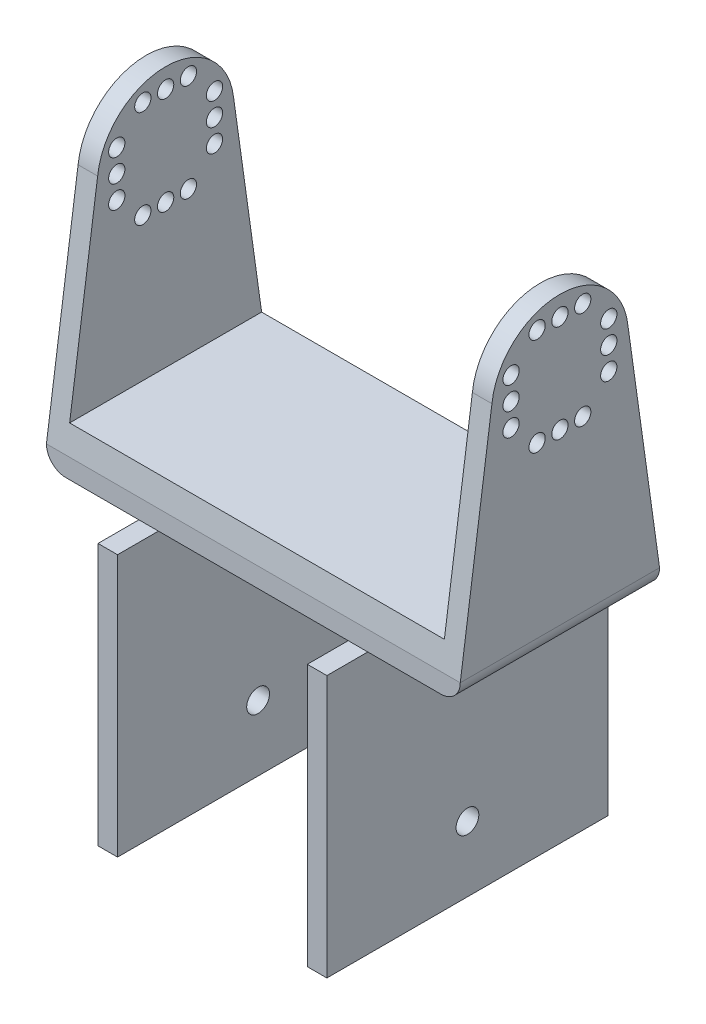
from build123d import *

# Parameters (mm, degrees)
SKETCH2_W           = 63.52
SKETCH2_H           = 30.59
BOSS_EXTRUDE1_DEPTH = 7
SKETCH3_W           = 3
SKETCH3_H           = 30.59
BOSS_EXTRUDE2_DEPTH = 40
FILLET2_R           = 3
SKETCH4_R           = 1.25
CUT_EXTRUDE2_DEPTH  = 70
SKETCH14_W          = 3
SKETCH14_H          = 43.15
BOSS_EXTRUDE5_DEPTH = 40.2
SKETCH15_R          = 1.75
CUT_EXTRUDE9_DEPTH  = 40


with BuildPart() as part:
    # Sketch2 → Boss-Extrude1 (new body)
    with BuildSketch(Plane(origin=(0, 0, 0), x_dir=(1, 0, 0), z_dir=(0, 1, 0))):
        with Locations((-20.26308022, 14.924105874)):
            Rectangle(SKETCH2_W, SKETCH2_H)
    extrude(amount=BOSS_EXTRUDE1_DEPTH)

    # Sketch3 → Boss-Extrude2 (add)
    with BuildSketch(Plane(origin=(0, 7, 0), x_dir=(1, 0, 0), z_dir=(0, 1, 0))):
        with Locations((-50.52308022, 14.924105874)):
            Rectangle(SKETCH3_W, SKETCH3_H)
        with Locations((9.99691978, 14.924105874)):
            Rectangle(SKETCH3_W, SKETCH3_H)
    extrude(amount=BOSS_EXTRUDE2_DEPTH)

    # Fillet2
    fillet2_edges = [part.edges().sort_by_distance(p)[0] for p in [
        (11.49691978, 0, -14.924105874),
        (-52.02308022, 0, -14.924105874),
    ]]
    fillet(fillet2_edges, radius=FILLET2_R)

    # Sketch4 → Cut-Extrude2 (cut)
    with BuildSketch(Plane.ZY.offset(52.02308022)):
        with BuildLine():
            ThreePointArc((-25.359340899, 37.664418298), (-21.924948962, 44.325483759), (-14.924105874, 47))
            Line((-14.924105874, 47), (-30.219105874, 47))
            Line((-30.219105874, 47), (-30.219105874, 3))
            Line((-30.219105874, 3), (-25.359340899, 37.664418298))
        make_face()
        with BuildLine():
            Line((0.370894126, 47), (-14.924105874, 47))
            ThreePointArc((-14.924105874, 47), (-7.923262787, 44.325483759), (-4.488870849, 37.664418298))
            Line((-4.488870849, 37.664418298), (0.370894126, 3))
            Line((0.370894126, 3), (0.370894126, 47))
        make_face()
        with Locations((-7.424105874, 36.5)):
            Circle(SKETCH4_R)
        with Locations((-7.424105874, 40)):
            Circle(SKETCH4_R)
        with Locations((-7.424105874, 33)):
            Circle(SKETCH4_R)
        with Locations((-14.924105874, 29)):
            Circle(SKETCH4_R)
        with Locations((-11.424105874, 29)):
            Circle(SKETCH4_R)
        with Locations((-18.424105874, 29)):
            Circle(SKETCH4_R)
        with Locations((-22.424105874, 36.5)):
            Circle(SKETCH4_R)
        with Locations((-22.424105874, 40)):
            Circle(SKETCH4_R)
        with Locations((-22.424105874, 33)):
            Circle(SKETCH4_R)
        with Locations((-11.424105874, 44)):
            Circle(SKETCH4_R)
        with Locations((-18.424105874, 44)):
            Circle(SKETCH4_R)
        with Locations((-14.924105874, 44)):
            Circle(SKETCH4_R)
    extrude(amount=-CUT_EXTRUDE2_DEPTH, mode=Mode.SUBTRACT)

    # Sketch14 → Boss-Extrude5 (add)
    with BuildSketch(Plane.XZ):
        with Locations((-36.32808022, -14.924105874)):
            Rectangle(SKETCH14_W, SKETCH14_H)
        with Locations((-4.19808022, -14.924105874)):
            Rectangle(SKETCH14_W, SKETCH14_H)
    extrude(amount=BOSS_EXTRUDE5_DEPTH)

    # Sketch15 → Cut-Extrude9 (cut)
    with BuildSketch(Plane.ZY.offset(37.82808022)):
        with Locations((-14.924105874, -30.15)):
            Circle(SKETCH15_R)
        with Locations((-14.924105874, -10.05)):
            Circle(SKETCH15_R)
    extrude(amount=-CUT_EXTRUDE9_DEPTH, mode=Mode.SUBTRACT)


solid = part.part
